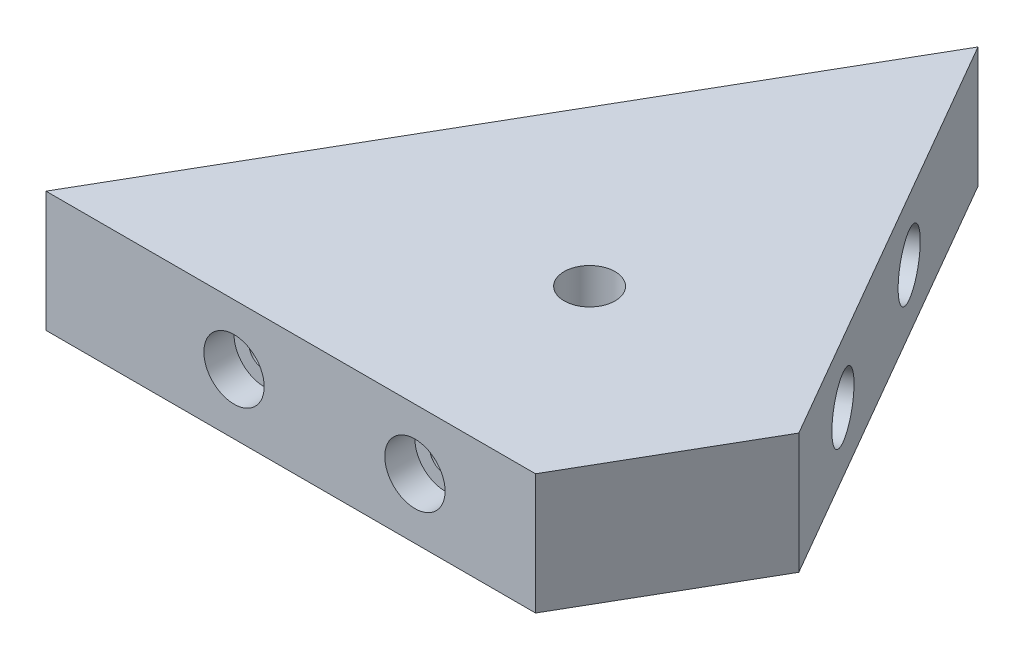
from build123d import *

# Parameters (mm, degrees)
BOSS_EXTRUDE1_DEPTH = 25.4
SKETCH2_R           = 6.35
CUT_EXTRUDE1_DEPTH  = 6.35
SKETCH3_R           = 3.2639
CUT_EXTRUDE2_DEPTH  = 16.51
SKETCH4_R           = 3.2639
CUT_EXTRUDE3_DEPTH  = 16.51
SKETCH5_R           = 5.3578125
CUT_EXTRUDE4_DEPTH  = 280.690442894


with BuildPart() as part:
    # Sketch1 → Boss-Extrude1 (new body)
    with BuildSketch(Plane(origin=(0, 0, 0), x_dir=(1, 0, 0), z_dir=(0, 1, 0))):
        Polygon((119.068292428, -241.162389864), (129.21607637, -223.585912492), (51.895065274, -178.944605922), (15.973610966, -241.162389864), align=None)
    boss_extrude1 = extrude(amount=BOSS_EXTRUDE1_DEPTH)

    # Sketch2 → Cut-Extrude1 (cut)
    with BuildSketch(Plane.XY.offset(241.162389864)):
        with Locations((55.568292428, 12.7)):
            Circle(SKETCH2_R)
        with Locations((93.668292428, 12.7)):
            Circle(SKETCH2_R)
    cut_extrude1 = extrude(amount=-CUT_EXTRUDE1_DEPTH, mode=Mode.SUBTRACT)

    # Sketch3 → Cut-Extrude2 (cut)
    with BuildSketch(Plane.XY.offset(234.812389864)):
        with Locations((55.568292428, 12.7)):
            Circle(SKETCH3_R)
    cut_extrude2 = extrude(amount=-CUT_EXTRUDE2_DEPTH, mode=Mode.SUBTRACT)

    # Sketch4 → Cut-Extrude3 (cut)
    with BuildSketch(Plane.XY.offset(234.812389864)):
        with Locations((93.668292428, 12.7)):
            Circle(SKETCH4_R)
    cut_extrude3 = extrude(amount=-CUT_EXTRUDE3_DEPTH, mode=Mode.SUBTRACT)

    # Mirror1: Boss-Extrude1, Cut-Extrude1, Cut-Extrude2, Cut-Extrude3 across plane
    add(boss_extrude1.mirror(Plane(origin=(51.895065274, 25.4, 178.944605922), x_dir=(0.8660254037844389, 0, 0.4999999999999996), z_dir=(-0.49999999999999983, 0, 0.8660254037844388))))
    add(cut_extrude1.mirror(Plane(origin=(51.895065274, 25.4, 178.944605922), x_dir=(0.8660254037844389, 0, 0.4999999999999996), z_dir=(-0.49999999999999983, 0, 0.8660254037844388))), mode=Mode.SUBTRACT)
    add(cut_extrude2.mirror(Plane(origin=(51.895065274, 25.4, 178.944605922), x_dir=(0.8660254037844389, 0, 0.4999999999999996), z_dir=(-0.49999999999999983, 0, 0.8660254037844388))), mode=Mode.SUBTRACT)
    add(cut_extrude3.mirror(Plane(origin=(51.895065274, 25.4, 178.944605922), x_dir=(0.8660254037844389, 0, 0.4999999999999996), z_dir=(-0.49999999999999983, 0, 0.8660254037844388))), mode=Mode.SUBTRACT)

    # Sketch5 → Cut-Extrude4 (cut, through all)
    with BuildSketch(Plane(origin=(0, 25.4, 0), x_dir=(1, 0, 0), z_dir=(0, 1, 0))):
        with Locations(Location((90.555570822, -201.265259207, 0), (0, 0, 270))):
            Circle(SKETCH5_R)
    extrude(amount=-CUT_EXTRUDE4_DEPTH, mode=Mode.SUBTRACT)


solid = part.part
